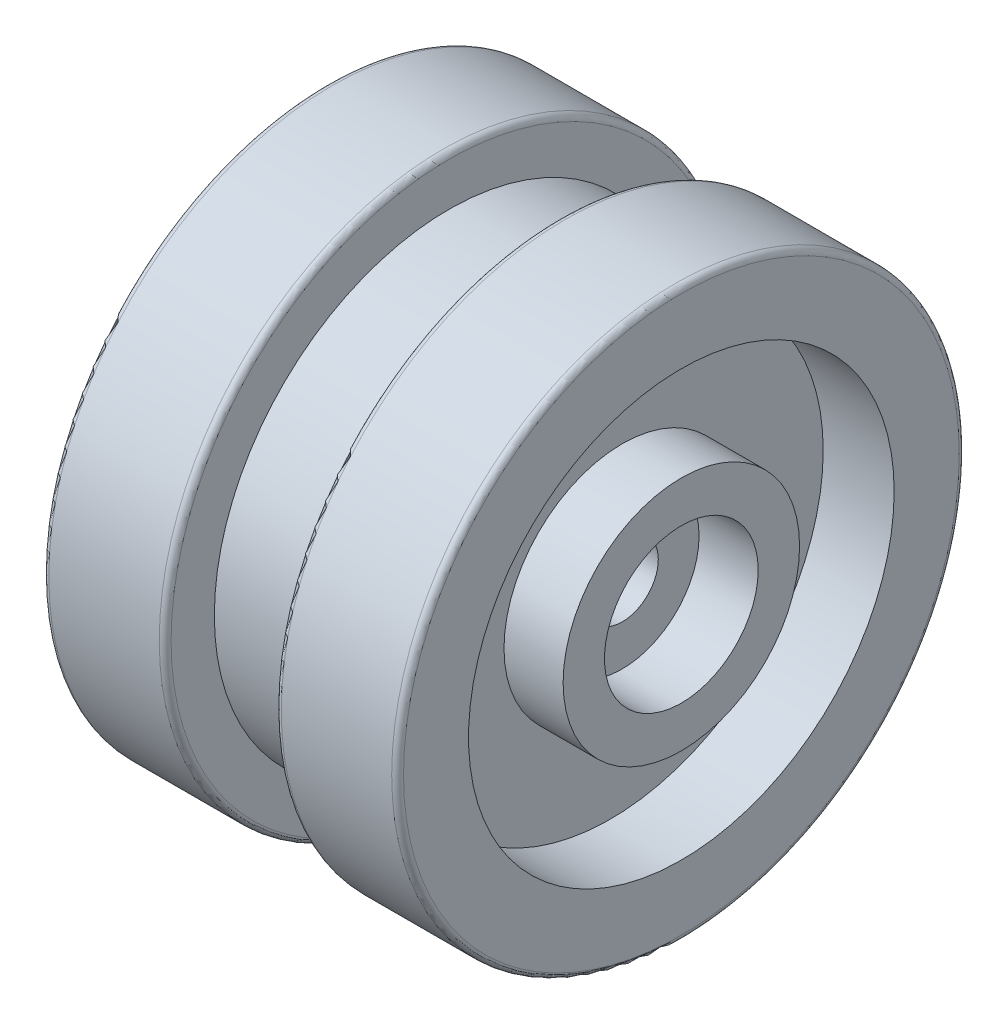
from build123d import *

# Parameters (mm, degrees)
SKETCH3_R           = 2
CUT_EXTRUDE1_DEPTH  = 58.27924924
FILLET2_R           = 0.5
SKETCH4_R           = 18
SKETCH4_R_2         = 6
CUT_EXTRUDE2_DEPTH  = 6
CUT_EXTRUDE3_START  = -6
SKETCH5_R           = 18
CUT_EXTRUDE3_DEPTH  = 6
SKETCH6_R           = 10
BOSS_EXTRUDE1_DEPTH = 6
SKETCH8_R           = 8
BOSS_EXTRUDE2_DEPTH = 10
SKETCH10_R          = 6.5
CUT_EXTRUDE5_DEPTH  = 5
SKETCH11_R          = 10
BOSS_EXTRUDE3_DEPTH = 5
CUT_EXTRUDE6_START  = -5
SKETCH12_R          = 6.5
CUT_EXTRUDE6_DEPTH  = 5
SKETCH7_R           = 3.05
CUT_EXTRUDE8_DEPTH  = 58.279249356


with BuildPart() as part:
    # Sketch2 → Revolve1 (revolve)
    with BuildSketch(Plane.XY, mode=Mode.PRIVATE) as revolve1_sk:
        Polygon((-2.085200875, 1.355739462), (7.234799125, 1.355739462), (7.234799125, 5.515739462), (17.574799125, 5.515739462), (17.574799125, -18.484260538), (-12.425200875, -18.484260538), (-12.425200875, 5.515739462), (-2.085200875, 5.515739462), align=None)
    revolve(revolve1_sk.sketch.rotate(Axis((-12.425200875, -18.484260538, 0), (1, 0, 0)), 90), axis=Axis((-12.425200875, -18.484260538, 0), (1, 0, 0)))

    # Sketch3 → Cut-Extrude1 (cut, through all)
    with BuildSketch(Plane(origin=(17.574799125, 0, 0), x_dir=(0, 0, -1), z_dir=(1, 0, 0))):
        with Locations((0, -18.484260538)):
            Circle(SKETCH3_R)
    extrude(amount=-CUT_EXTRUDE1_DEPTH, mode=Mode.SUBTRACT)

    # Fillet2
    fillet2_edges = [part.edges().sort_by_distance(p)[0] for p in [
        (-2.085200875, -18.484260538, -24),
        (7.234799125, -18.484260538, -24),
        (17.574799125, -18.484260538, -24),
        (-12.425200875, -18.484260538, -24),
    ]]
    fillet(fillet2_edges, radius=FILLET2_R)

    # Sketch4 → Cut-Extrude2 (cut)
    with BuildSketch(Plane(origin=(17.574799125, 0, 0), x_dir=(0, 0, -1), z_dir=(1, 0, 0))):
        with Locations((0, -18.484260538)):
            Circle(SKETCH4_R)
        with Locations((0, -18.484260538)):
            Circle(SKETCH4_R_2, mode=Mode.SUBTRACT)
    extrude(amount=-CUT_EXTRUDE2_DEPTH, mode=Mode.SUBTRACT)

    # Sketch5 → Cut-Extrude3 (cut)
    with BuildSketch(Plane.ZY.offset(12.425200875).offset(CUT_EXTRUDE3_START)):
        with Locations(Location((0, -18.484260538, 0), (0, 0, 180))):
            Circle(SKETCH5_R)
    extrude(amount=CUT_EXTRUDE3_DEPTH, mode=Mode.SUBTRACT)

    # Sketch6 → Boss-Extrude1 (add, through all)
    with BuildSketch(Plane.ZY.offset(6.425200875)):
        with Locations((0, -18.484260538)):
            Circle(SKETCH6_R)
    extrude(amount=BOSS_EXTRUDE1_DEPTH)

    # Sketch8 → Boss-Extrude2 (add)
    with BuildSketch(Plane(origin=(17.574799125, 0, 0), x_dir=(0, 0, -1), z_dir=(1, 0, 0))):
        with Locations((0, -18.484260538)):
            Circle(SKETCH8_R)
    extrude(amount=-BOSS_EXTRUDE2_DEPTH)

    # Sketch10 → Cut-Extrude5 (cut)
    with BuildSketch(Plane.ZY.offset(12.425200875)):
        with Locations((0, -18.484260538)):
            Circle(SKETCH10_R)
    extrude(amount=-CUT_EXTRUDE5_DEPTH, mode=Mode.SUBTRACT)

    # Sketch11 → Boss-Extrude3 (add)
    with BuildSketch(Plane(origin=(17.574799125, 0, 0), x_dir=(0, 0, -1), z_dir=(1, 0, 0))):
        with Locations(Location((0, -18.484260538, 0), (0, 0, 180))):
            Circle(SKETCH11_R)
    extrude(amount=-BOSS_EXTRUDE3_DEPTH)

    # Sketch12 → Cut-Extrude6 (cut)
    with BuildSketch(Plane(origin=(17.574799125, 0, 0), x_dir=(0, 0, -1), z_dir=(1, 0, 0)).offset(CUT_EXTRUDE6_START)):
        with Locations(Location((0, -18.484260538, 0), (0, 0, 180))):
            Circle(SKETCH12_R)
    extrude(amount=CUT_EXTRUDE6_DEPTH, mode=Mode.SUBTRACT)

    # Sketch7 → Cut-Extrude8 (cut, through all)
    with BuildSketch(Plane.ZY.offset(12.425200875)):
        with Locations((0, -18.484260538)):
            Circle(SKETCH7_R)
    extrude(amount=-CUT_EXTRUDE8_DEPTH, mode=Mode.SUBTRACT)


solid = part.part
